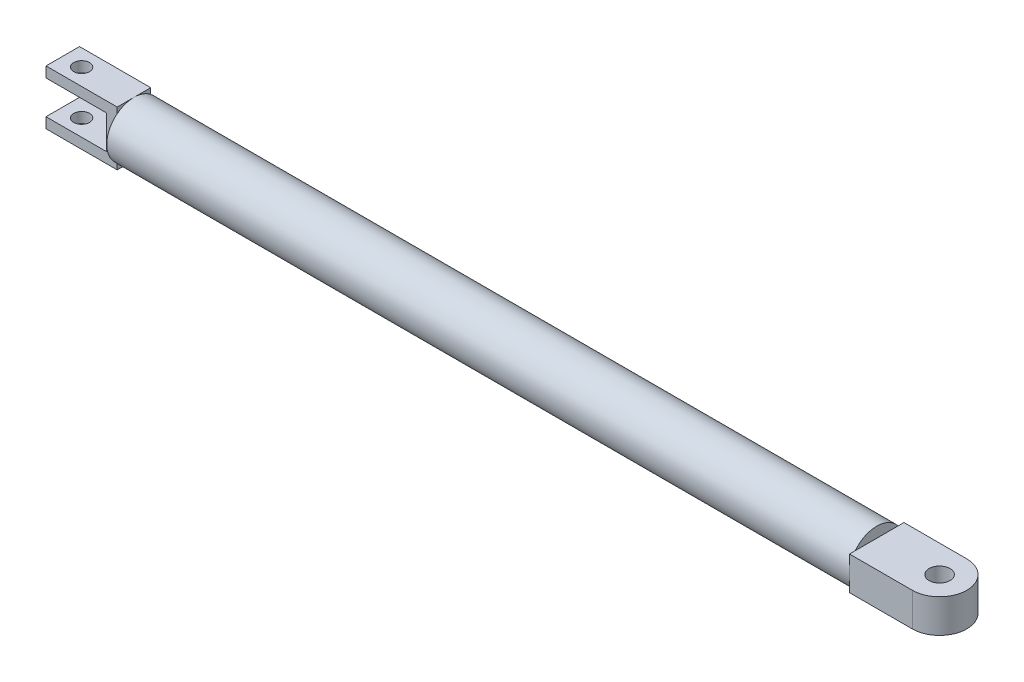
from build123d import *

# Parameters (mm, degrees)
SKETCH1_R                = 8.255
BOSS_EXTRUDE1_DEPTH      = 225.171
BOSS_EXTRUDE2_DEPTH      = 5.08
BOSS_EXTRUDE2_DEPTH_BACK = 5.08
SKETCH2_R                = 3.175
BOSS_EXTRUDE3_DEPTH      = 5.08
BOSS_EXTRUDE3_DEPTH_BACK = 5.08
CUT_EXTRUDE1_DEPTH       = 253.962641167
CUT_EXTRUDE1_DEPTH_BACK  = 253.962641167
SKETCH4_R                = 2.398254968


with BuildPart() as part:
    # Sketch1 → Boss-Extrude1 (new body)
    with BuildSketch(Plane(origin=(0, 0, 0), x_dir=(0, 0, -1), z_dir=(1, 0, 0))):
        Circle(SKETCH1_R)
    extrude(amount=BOSS_EXTRUDE1_DEPTH)

    # Sketch2 → Boss-Extrude2 (add, two sides: drawn at the far end of the back side and taken through both)
    with BuildSketch(Plane(origin=(0, 0, 0), x_dir=(1, 0, 0), z_dir=(0, 1, 0)).offset(-BOSS_EXTRUDE2_DEPTH_BACK)):
        with BuildLine():
            Line((225.171, -8.255), (225.171, 8.255))
            Line((225.171, 8.255), (244.221, 8.255))
            ThreePointArc((244.221, 8.255), (252.476, 0), (244.221, -8.255))
            Line((244.221, -8.255), (225.171, -8.255))
        make_face()
        with Locations(Location((244.221, 0, 0), (0, 0, 270))):
            Circle(SKETCH2_R, mode=Mode.SUBTRACT)
    extrude(amount=BOSS_EXTRUDE2_DEPTH + BOSS_EXTRUDE2_DEPTH_BACK)

    # Sketch3 → Boss-Extrude3 (add, two sides: drawn at the far end of the back side and taken through both)
    with BuildSketch(Plane.XY.offset(-BOSS_EXTRUDE3_DEPTH_BACK)):
        Polygon((0, -8.255), (0, 8.255), (-21.59, 8.255), (-21.59, 5.08), (-3.175, 5.08), (-3.175, -5.08), (-21.59, -5.08), (-21.59, -8.255), align=None)
    extrude(amount=BOSS_EXTRUDE3_DEPTH + BOSS_EXTRUDE3_DEPTH_BACK)

    # Sketch4 → Cut-Extrude1 (cut, two sides: drawn at the far end of the back side and taken through both)
    with BuildSketch(Plane(origin=(0, -5.08, 0), x_dir=(1, 0, 0), z_dir=(0, 1, 0)).offset(-CUT_EXTRUDE1_DEPTH_BACK)):
        with Locations(Location((-15.875, 0, 0), (0, 0, 180))):
            Circle(SKETCH4_R)
    extrude(amount=CUT_EXTRUDE1_DEPTH + CUT_EXTRUDE1_DEPTH_BACK, mode=Mode.SUBTRACT)


solid = part.part
